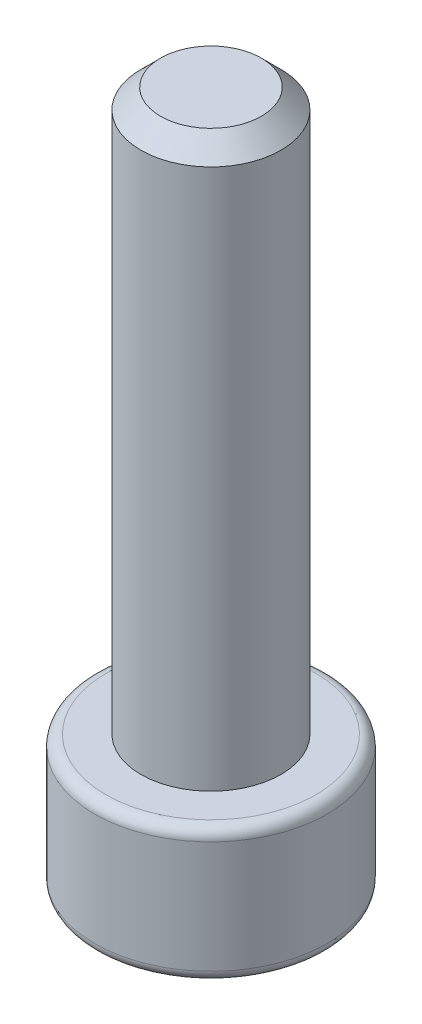
from build123d import *

# Parameters (mm, degrees)
SKETCH1_R               = 4.15
BOSS_EXTRUDE1_DEPTH     = 4.8
SKETCH2_R               = 2.5
BOSS_EXTRUDE2_DEPTH     = 20
CUT_EXTRUDE1_DEPTH      = 26.484995586
CUT_EXTRUDE1_DEPTH_BACK = 2.5
CHAMFER1_SIZE           = 0.7
FILLET1_R               = 0.4


with BuildPart() as part:
    # Sketch1 → Boss-Extrude1 (new body)
    with BuildSketch(Plane(origin=(0, 0, 0), x_dir=(1, 0, 0), z_dir=(0, 1, 0))):
        with Locations(Location((0, 0, 0), (0, 0, 270))):
            Circle(SKETCH1_R)
    extrude(amount=BOSS_EXTRUDE1_DEPTH)

    # Sketch2 → Boss-Extrude2 (add)
    with BuildSketch(Plane(origin=(0, 4.8, 0), x_dir=(1, 0, 0), z_dir=(0, 1, 0))):
        with Locations(Location((0, 0, 0), (0, 0, 270))):
            Circle(SKETCH2_R)
    extrude(amount=BOSS_EXTRUDE2_DEPTH)

    # Sketch3 → Cut-Extrude1 (cut, two sides: drawn at the far end of the back side and taken through both)
    with BuildSketch(Plane.XZ.offset(-CUT_EXTRUDE1_DEPTH_BACK)):
        Polygon((2.886751346, 0), (1.443375673, 2.5), (-1.443375673, 2.5), (-2.886751346, 0), (-1.443375673, -2.5), (1.443375673, -2.5), align=None)
    extrude(amount=CUT_EXTRUDE1_DEPTH + CUT_EXTRUDE1_DEPTH_BACK, mode=Mode.SUBTRACT)

    # Chamfer1
    chamfer1_edges = [part.edges().sort_by_distance(p)[0] for p in [
        (0, 24.8, -2.5),
    ]]
    chamfer(chamfer1_edges, length=CHAMFER1_SIZE)

    # Fillet1
    fillet1_edges = [part.edges().sort_by_distance(p)[0] for p in [
        (0, 0, -4.15),
        (0, 4.8, -4.15),
    ]]
    fillet(fillet1_edges, radius=FILLET1_R)


solid = part.part
